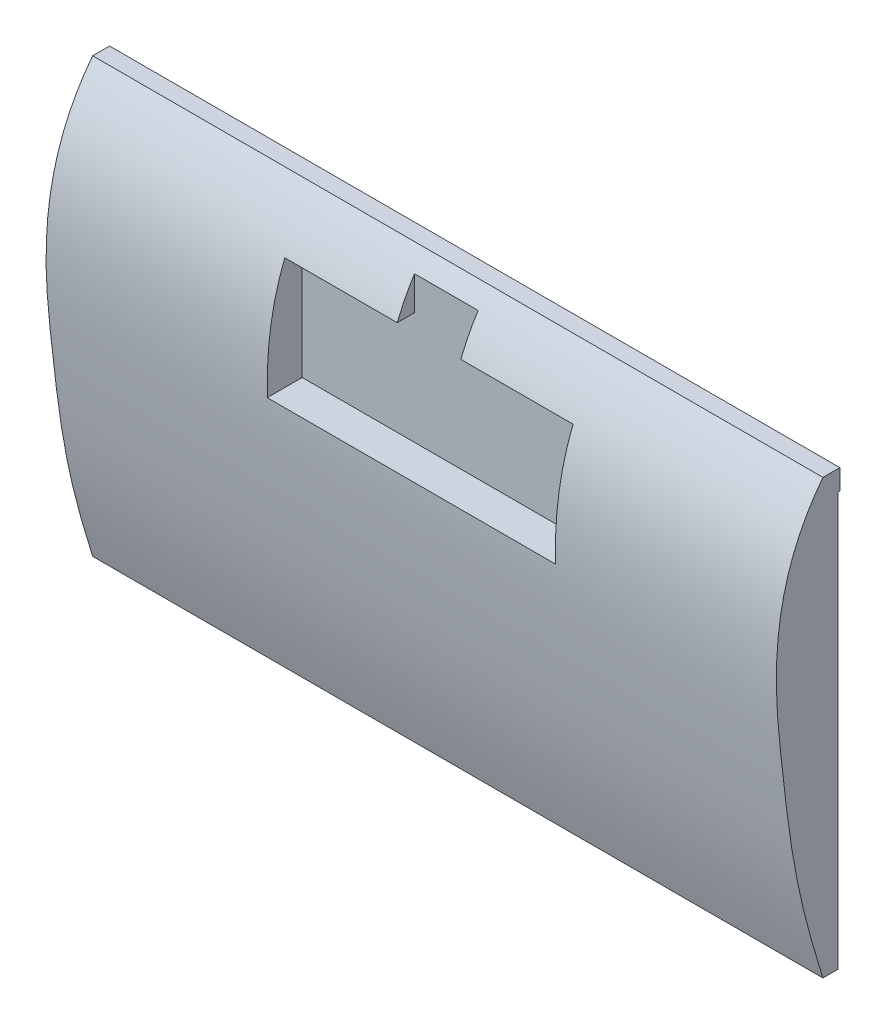
from build123d import *

# Parameters (mm, degrees)
SKETCH_1_W          = 539.7
SKETCH_1_H          = 320.4
EXTRUDE_1_DEPTH     = 11
EXTRUDE_2_DEPTH     = 539.7
SKETCH_4_W          = 213
SKETCH_4_H          = 83
SKETCH_4_W_2        = 47
SKETCH_4_H_2        = 37
CUT_EXTRUDE_1_DEPTH = 50
SKETCH_5_W          = 539.7
SKETCH_5_H          = 15
EXTRUDE_3_DEPTH     = 1.5


with BuildPart() as part:
    # 草圖1 → 填料-伸長1 (new body)
    with BuildSketch(Plane.XY):
        Rectangle(SKETCH_1_W, SKETCH_1_H)
    extrude(amount=EXTRUDE_1_DEPTH)

    # 草圖3 → 填料-伸長2 (add)
    with BuildSketch(Plane.ZY.offset(269.85)):
        with BuildLine():
            Line((11, 160.2), (11, -160.2))
            add(Edge.make_bspline(
                [(11, 160.2), (53.418678894, 105.581967835), (38.074193493, -46.19843894), (30.140931245, -99.160452943), (11, -160.2)],
                knots=[0, 0, 0, 0, 0.430834625, 1, 1, 1, 1], degree=3))
        make_face()
    extrude(amount=-EXTRUDE_2_DEPTH)

    # 草圖4 → 除料-伸長1 (cut)
    with BuildSketch(Plane(origin=(0, 0, 19.5), x_dir=(-1, 0, 0), z_dir=(0, 0, -1))):
        with Locations((0, 81.7)):
            Rectangle(SKETCH_4_W, SKETCH_4_H)
        with Locations((0, 141.7)):
            Rectangle(SKETCH_4_W_2, SKETCH_4_H_2)
    extrude(amount=-CUT_EXTRUDE_1_DEPTH, mode=Mode.SUBTRACT)

    # 草圖5 → 填料-伸長3 (add)
    with BuildSketch(Plane(origin=(0, 0, 0), x_dir=(-1, 0, 0), z_dir=(0, 0, -1))):
        with Locations((0, 152.7)):
            Rectangle(SKETCH_5_W, SKETCH_5_H)
    extrude(amount=EXTRUDE_3_DEPTH)


solid = part.part
